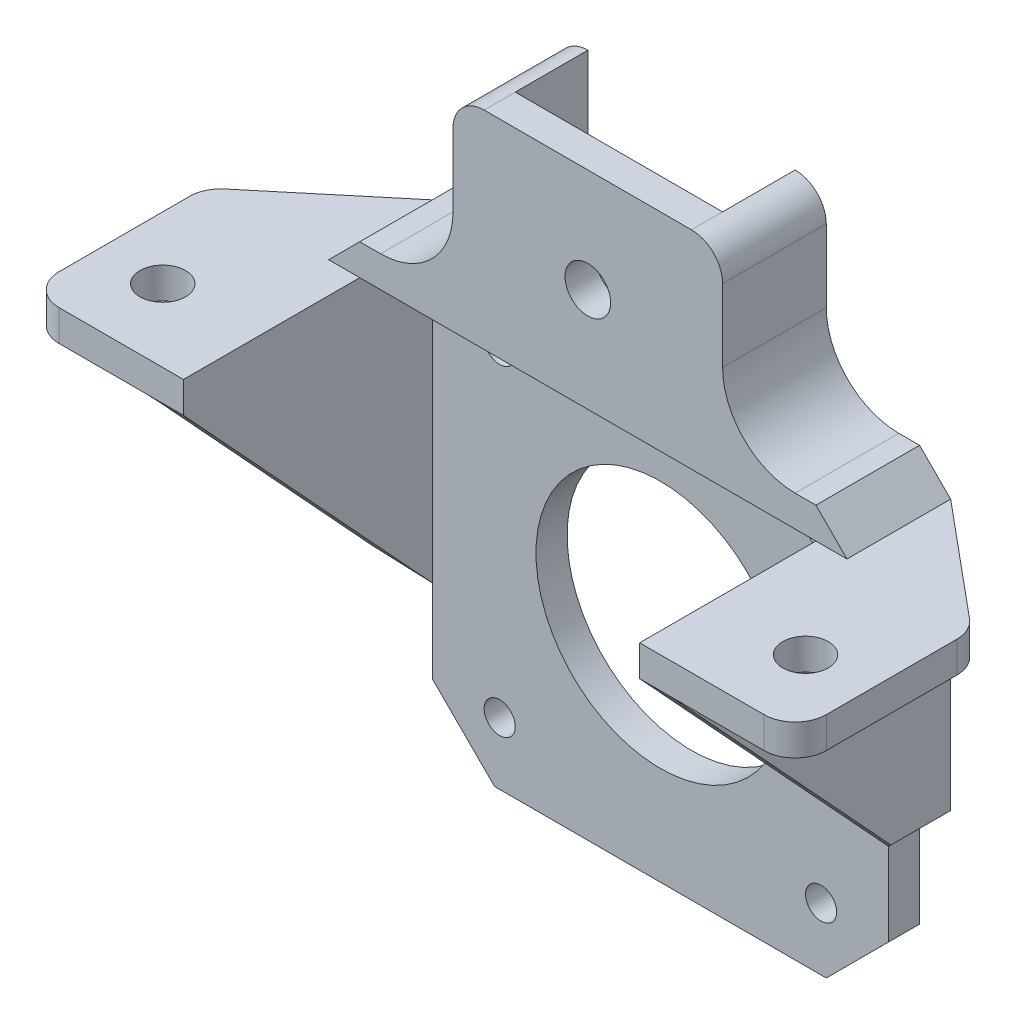
from build123d import *

# Parameters (mm, degrees)
BOSS_EXTRUDE1_DEPTH     = 3
BOSS_EXTRUDE2_DEPTH     = 27
BOSS_EXTRUDE2_2_DEPTH   = 27
BOSS_EXTRUDE3_DEPTH     = 10
SKETCH4_W               = 26
SKETCH4_H               = 17
BOSS_EXTRUDE4_DEPTH     = 7
CUT_EXTRUDE1_DEPTH      = 80.342611502
SKETCH6_R               = 2.2
CUT_EXTRUDE2_DEPTH      = 61.811183182
SKETCH7_W               = 20
SKETCH7_H               = 7
CUT_EXTRUDE3_DEPTH      = 17
SKETCH8_R               = 12
SKETCH8_R_2             = 1.5
CUT_EXTRUDE4_DEPTH      = 61.557823607
SKETCH9_R               = 2.2
CUT_EXTRUDE5_DEPTH      = 59.139917441
FILLET1_R               = 7
FILLET2_R               = 3
CHAMFER1_SIZE           = 6
CUT_EXTRUDE6_DEPTH      = 61.557823607
CUT_EXTRUDE6_DEPTH_BACK = 61.557823607
FILLET3_R               = 1


with BuildPart() as part:
    # Sketch1 → Boss-Extrude1 (new body)
    with BuildSketch(Plane.XY):
        Polygon((-13, 21.5), (-13, 41.5), (13, 41.5), (13, 21.5), (22, 21.5), (22, -21.5), (-22, -21.5), (-22, 21.5), align=None)
    extrude(amount=BOSS_EXTRUDE1_DEPTH)



with BuildPart() as body_2:
    # Sketch2 → Boss-Extrude2 (new body)
    with BuildSketch(Plane(origin=(0, 0, 0), x_dir=(-1, 0, 0), z_dir=(0, 0, -1))):
        Polygon((37, 21.5), (22, 21.5), (22, -7.5), (25, -7.5), (25, 18.5), (37, 18.5), align=None)
    extrude(amount=-BOSS_EXTRUDE2_DEPTH)


with BuildPart() as body_3:
    # Sketch2 → Boss-Extrude2 2 (new body)
    with BuildSketch(Plane(origin=(0, 0, 0), x_dir=(-1, 0, 0), z_dir=(0, 0, -1))):
        Polygon((-37, 18.5), (-37, 21.5), (-22, 21.5), (-22, -7.5), (-25, -7.5), (-25, 18.5), align=None)
    extrude(amount=-BOSS_EXTRUDE2_2_DEPTH)


with BuildPart() as part_1:
    add(part.part)

    add(body_2.part)  # Boss-Extrude3 merges body 2

    add(body_3.part)  # Boss-Extrude3 merges body 3
    # Sketch3 → Boss-Extrude3 (add)
    with BuildSketch(Plane(origin=(0, 0, 0), x_dir=(-1, 0, 0), z_dir=(0, 0, -1))):
        Polygon((-25, 21.5), (-22, 24.5), (22, 24.5), (25, 21.5), align=None)
    extrude(amount=-BOSS_EXTRUDE3_DEPTH)

    # Sketch4 → Boss-Extrude4 (add)
    with BuildSketch(Plane.XY.offset(3)):
        with Locations((0, 33)):
            Rectangle(SKETCH4_W, SKETCH4_H)
    extrude(amount=BOSS_EXTRUDE4_DEPTH)

    # Sketch5 → Cut-Extrude1 (cut, through all)
    with BuildSketch(Plane(origin=(25, 0, 0), x_dir=(0, 0, -1), z_dir=(1, 0, 0))):
        Polygon((-27, 18.5), (-3, -7.5), (-27, -7.5), align=None)
    extrude(amount=-CUT_EXTRUDE1_DEPTH, mode=Mode.SUBTRACT)

    # Sketch6 → Cut-Extrude2 (cut, through all)
    with BuildSketch(Plane.XZ.offset(-18.5)):
        with Locations(Location((31, 20, 0), (0, 0, 270))):
            Circle(SKETCH6_R)
        with Locations(Location((-31, 20, 0), (0, 0, 180))):
            Circle(SKETCH6_R)
        Polygon((25, 0), (37, 10), (37, 0), align=None)
        Polygon((-37, 0), (-25, 0), (-37, 10), align=None)
    extrude(amount=-CUT_EXTRUDE2_DEPTH, mode=Mode.SUBTRACT)

    # Sketch7 → Cut-Extrude3 (cut)
    with BuildSketch(Plane(origin=(0, 41.5, 0), x_dir=(1, 0, 0), z_dir=(0, 1, 0))):
        with Locations((0, -3.5)):
            Rectangle(SKETCH7_W, SKETCH7_H)
    extrude(amount=-CUT_EXTRUDE3_DEPTH, mode=Mode.SUBTRACT)

    # Sketch8 → Cut-Extrude4 (cut, through all)
    with BuildSketch(Plane.XY.offset(3)):
        Circle(SKETCH8_R)
        with Locations((-15.5, 15.5)):
            Circle(SKETCH8_R_2)
        with Locations((15.5, 15.5)):
            Circle(SKETCH8_R_2)
        with Locations((15.5, -15.5)):
            Circle(SKETCH8_R_2)
        with Locations((-15.5, -15.5)):
            Circle(SKETCH8_R_2)
    extrude(amount=-CUT_EXTRUDE4_DEPTH, mode=Mode.SUBTRACT)

    # Sketch9 → Cut-Extrude5 (cut, through all)
    with BuildSketch(Plane.XY.offset(10)):
        with Locations((0, 31.5)):
            Circle(SKETCH9_R)
    extrude(amount=-CUT_EXTRUDE5_DEPTH, mode=Mode.SUBTRACT)

    # Fillet1
    fillet1_edges = [part_1.edges().sort_by_distance(p)[0] for p in [
        (13, 24.5, 5),
        (-13, 24.5, 5),
    ]]
    fillet(fillet1_edges, radius=FILLET1_R)

    # Fillet2
    fillet2_edges = [part_1.edges().sort_by_distance(p)[0] for p in [
        (13, 41.5, 5),
        (-13, 41.5, 5),
        (-37, 20, 10),
        (37, 20, 10),
        (-37, 20, 27),
        (37, 20, 27),
    ]]
    fillet(fillet2_edges, radius=FILLET2_R)

    # Chamfer1
    chamfer1_edges = [part_1.edges().sort_by_distance(p)[0] for p in [
        (22, -21.5, 1.5),
        (-22, -21.5, 1.5),
    ]]
    chamfer(chamfer1_edges, length=CHAMFER1_SIZE)

    # Sketch10 → Cut-Extrude6 (cut, two sides: drawn at the far end of the back side and taken through both)
    with BuildSketch(Plane.XY.offset(3).offset(-CUT_EXTRUDE6_DEPTH_BACK)):
        Polygon((22, -7.5), (25, -4.510011911), (25, -7.5), align=None)
        Polygon((-22, -7.5), (-25, -7.5), (-25, -4.510005014), align=None)
    extrude(amount=CUT_EXTRUDE6_DEPTH + CUT_EXTRUDE6_DEPTH_BACK, mode=Mode.SUBTRACT)

    # Fillet3
    fillet3_edges = [part_1.edges().sort_by_distance(p)[0] for p in [
        (-25, 18.5, 13.5),
        (25, 18.5, 13.5),
    ]]
    fillet(fillet3_edges, radius=FILLET3_R)


solid = part_1.part
